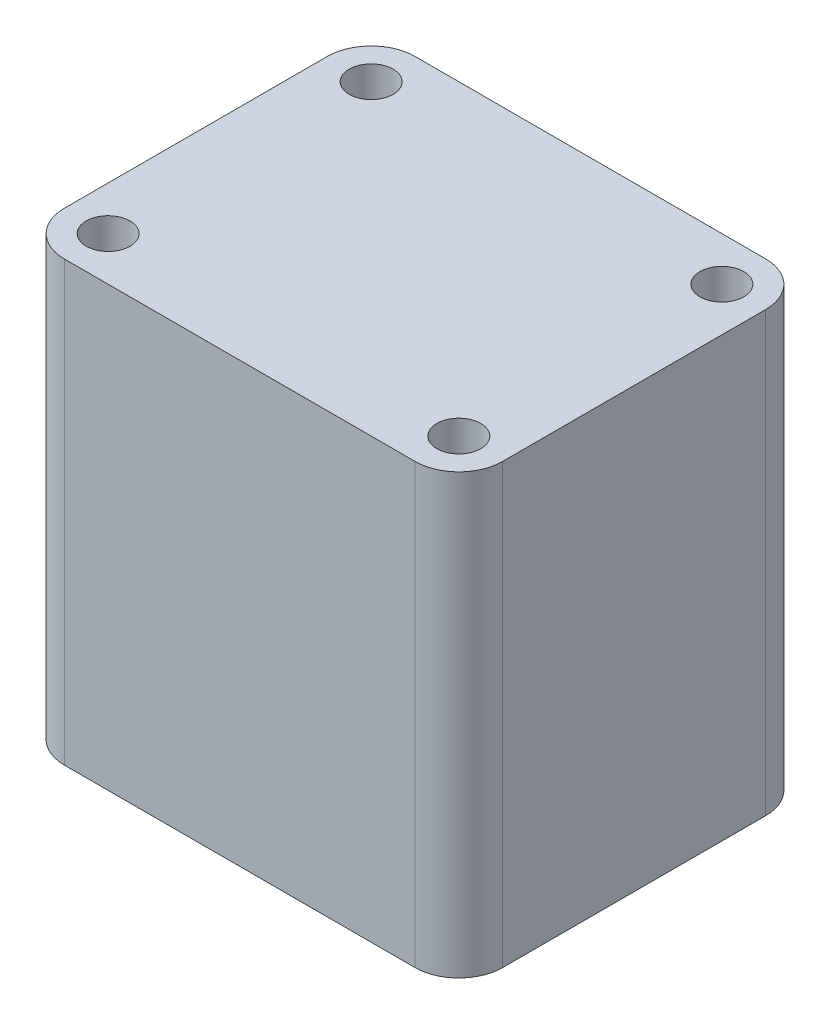
from build123d import *

# Parameters (mm, degrees)
CROQUIS1_W                                 = 100
CROQUIS1_H                                 = 80
SALIENTE_EXTRUIR1_DEPTH                    = 100
REDONDEO1_R                                = 10
CROQUIS2_R                                 = 5
CORTAR_EXTRUIR1_DEPTH                      = 119.74342087
SIMETR_A1_AT_THE_SECOND_PLANE_COPY_1_SKE_R = 5
SIMETR_A1_AT_THE_SECOND_PLANE_COPY_1_DEPTH = 119.74342087


with BuildPart() as part:
    # Croquis1 → Saliente-Extruir1 (new body)
    with BuildSketch(Plane(origin=(0, 0, 0), x_dir=(1, 0, 0), z_dir=(0, 1, 0))):
        Rectangle(CROQUIS1_W, CROQUIS1_H)
    extrude(amount=SALIENTE_EXTRUIR1_DEPTH)

    # Redondeo1
    redondeo1_edges = [part.edges().sort_by_distance(p)[0] for p in [
        (-50, 50, -40),
        (50, 50, -40),
        (50, 50, 40),
        (-50, 50, 40),
    ]]
    fillet(redondeo1_edges, radius=REDONDEO1_R)

    # Croquis2 → Cortar-Extruir1 (cut, through all)
    with BuildSketch(Plane(origin=(0, 100, 0), x_dir=(1, 0, 0), z_dir=(0, 1, 0))):
        with Locations(Location((-40, 30, 0), (0, 0, 270))):
            Circle(CROQUIS2_R)
    cortar_extruir1 = extrude(amount=-CORTAR_EXTRUIR1_DEPTH, mode=Mode.SUBTRACT)

    # Simetría1: Cortar-Extruir1 across plane
    add(cortar_extruir1.mirror(Plane.XY), mode=Mode.SUBTRACT)

    # Simetría1 at the second plane: Cortar-Extruir1 across plane
    add(cortar_extruir1.mirror(Plane(origin=(0, 0, 0), x_dir=(0, 0, 1), z_dir=(1, 0, 0))), mode=Mode.SUBTRACT)

    # Simetría1 at the second plane copy 1 ske → Simetría1 at the second plane copy 1 (cut, through all)
    with BuildSketch(Plane(origin=(0, 100, 0), x_dir=(-1, 0, 0), z_dir=(0, 1, 0))):
        with Locations(Location((-40, 30, 0), (0, 0, 270))):
            Circle(SIMETR_A1_AT_THE_SECOND_PLANE_COPY_1_SKE_R)
    extrude(amount=-SIMETR_A1_AT_THE_SECOND_PLANE_COPY_1_DEPTH, mode=Mode.SUBTRACT)


solid = part.part
